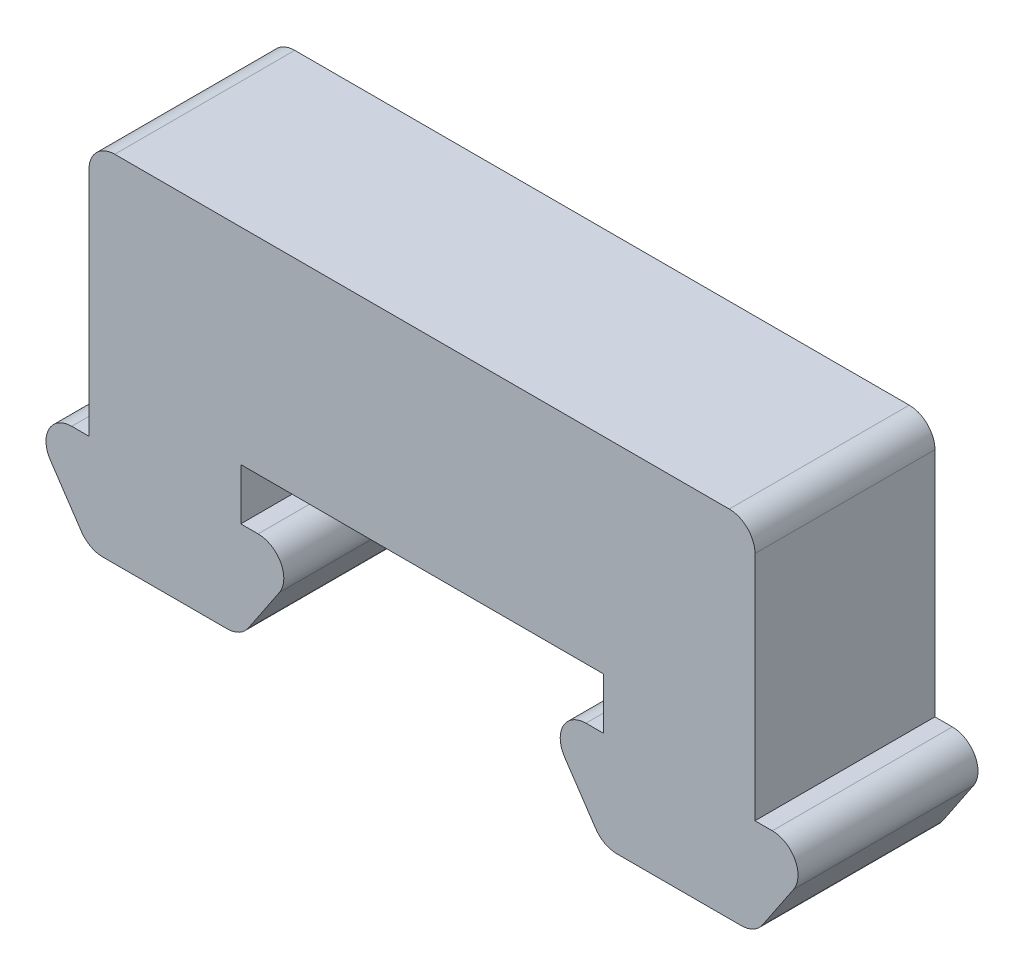
from build123d import *

# Parameters (mm, degrees)
BOSS_EXTRUDE1_DEPTH = 5
BOSS_EXTRUDE2_START = 5
SKETCH1_3_W         = 9.2
SKETCH1_3_H         = 6.5
BOSS_EXTRUDE2_DEPTH = 2
FILLET1_R           = 1


with BuildPart() as part:
    # Sketch1 → Boss-Extrude1 (new body)
    with BuildSketch(Plane.XY):
        Polygon((-12.95, 0), (-7.05, 0), (-7.05, 2), (-4.6, 2), (-4.6, 8.5), (4.6, 8.5), (4.6, 2), (7.05, 2), (7.05, 0), (12.95, 0), (12.95, 2), (12.95, 10), (-12.95, 10), (-12.95, 2), align=None)
        Polygon((-7.05, -3.8), (-12.95, -3.8), (-15.5, 0), (-4.5, 0), align=None)
        Polygon((4.5, 0), (15.5, 0), (12.95, -3.8), (7.05, -3.8), align=None)
    extrude(amount=BOSS_EXTRUDE1_DEPTH)

    # Sketch1<3> → Boss-Extrude2 (add)
    with BuildSketch(Plane.XY.offset(BOSS_EXTRUDE2_START)):
        with Locations((0, 5.25)):
            Rectangle(SKETCH1_3_W, SKETCH1_3_H)
        Polygon((-12.95, 0), (-7.05, 0), (-7.05, 2), (-4.6, 2), (-4.6, 8.5), (4.6, 8.5), (4.6, 2), (7.05, 2), (7.05, 0), (12.95, 0), (12.95, 2), (12.95, 10), (-12.95, 10), (-12.95, 2), align=None)
        Polygon((-7.05, -3.8), (-12.95, -3.8), (-15.5, 0), (-4.5, 0), align=None)
        Polygon((4.5, 0), (15.5, 0), (12.95, -3.8), (7.05, -3.8), align=None)
    extrude(amount=BOSS_EXTRUDE2_DEPTH)

    # Fillet1
    fillet1_edges = [part.edges().sort_by_distance(p)[0] for p in [
        (-4.5, 0, 3.5),
        (-7.05, -3.8, 3.5),
        (-12.95, -3.8, 3.5),
        (-15.5, 0, 3.5),
        (-12.95, 10, 3.5),
        (12.95, 10, 3.5),
        (15.5, 0, 3.5),
        (12.95, -3.8, 3.5),
        (7.05, -3.8, 3.5),
        (4.5, 0, 3.5),
        (4.6, 2, 2.5),
        (-4.6, 2, 2.5),
    ]]
    fillet(fillet1_edges, radius=FILLET1_R)


solid = part.part
